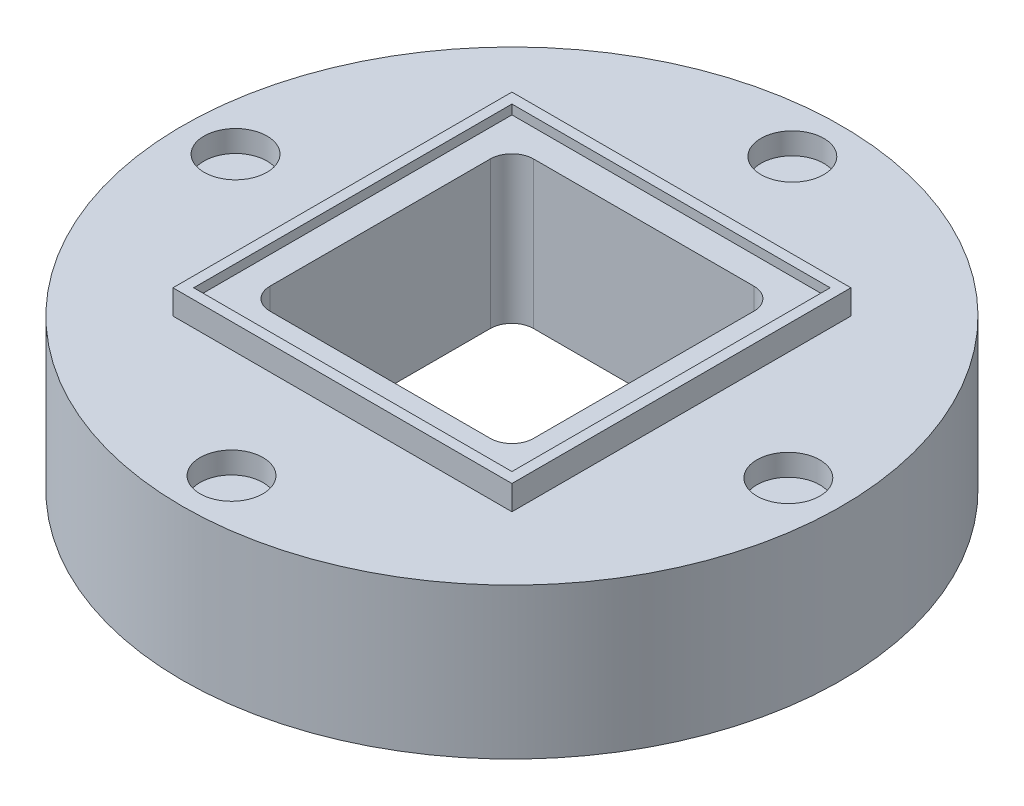
from build123d import *

# Parameters (mm, degrees)
SKETCH1_R           = 17.5
BOSS_EXTRUDE1_DEPTH = 8
SKETCH5_R           = 16.5
CUT_EXTRUDE2_DEPTH  = 1
SKETCH11_R          = 1.67
CUT_EXTRUDE5_DEPTH  = 1.15
CIRPATTERN1_COUNT   = 4
SKETCH13_W          = 18
SKETCH13_H          = 18
SKETCH13_W_2        = 16.9
SKETCH13_H_2        = 16.9
BOSS_EXTRUDE3_DEPTH = 1.3
SKETCH12_W          = 18
SKETCH12_H          = 18
BOSS_EXTRUDE2_DEPTH = 0.8
CUT_EXTRUDE6_DEPTH  = 27.266708968


with BuildPart() as part:
    # Sketch1 → Boss-Extrude1 (new body)
    with BuildSketch(Plane(origin=(0, 0, 0), x_dir=(1, 0, 0), z_dir=(0, 1, 0))):
        with Locations(Location((0, 0, 0), (0, 0, 270))):
            Circle(SKETCH1_R)
    extrude(amount=BOSS_EXTRUDE1_DEPTH)

    # Sketch5 → Cut-Extrude2 (cut)
    with BuildSketch(Plane.XZ):
        with Locations(Location((0, 0, 0), (0, 0, 270))):
            Circle(SKETCH5_R)
    extrude(amount=-CUT_EXTRUDE2_DEPTH, mode=Mode.SUBTRACT)

    # Sketch11 → Cut-Extrude5 (cut)
    with BuildSketch(Plane(origin=(0, 8, 0), x_dir=(1, 0, 0), z_dir=(0, 1, 0))):
        with Locations(Location((0.106708516, 14.783412681, 0), (0, 0, 270))):
            Circle(SKETCH11_R)
    cut_extrude5 = extrude(amount=-CUT_EXTRUDE5_DEPTH, mode=Mode.SUBTRACT)

    # CirPattern1: Cut-Extrude5 ×4 about axis
    cirpattern1_axis = Axis((0, 0, 0), (0, 1, 0))
    for i in range(1, CIRPATTERN1_COUNT):
        add(cut_extrude5.rotate(cirpattern1_axis, i * 360 / CIRPATTERN1_COUNT), mode=Mode.SUBTRACT)

    # Sketch13 → Boss-Extrude3 (add)
    with BuildSketch(Plane(origin=(0, 8, 0), x_dir=(1, 0, 0), z_dir=(0, 1, 0))):
        Rectangle(SKETCH13_W, SKETCH13_H)
        Rectangle(SKETCH13_W_2, SKETCH13_H_2, mode=Mode.SUBTRACT)
    extrude(amount=BOSS_EXTRUDE3_DEPTH)

    # Sketch12 → Boss-Extrude2 (add)
    with BuildSketch(Plane(origin=(0, 8, 0), x_dir=(1, 0, 0), z_dir=(0, 1, 0))):
        Rectangle(SKETCH12_W, SKETCH12_H)
    extrude(amount=BOSS_EXTRUDE2_DEPTH)

    # Sketch14 → Cut-Extrude6 (cut, through all)
    with BuildSketch(Plane(origin=(0, 8.8, 0), x_dir=(1, 0, 0), z_dir=(0, 1, 0))):
        with BuildLine():
            ThreePointArc((-7, -5.85), (-6.663172798, -6.663172798), (-5.85, -7))
            Line((-5.85, -7), (5.85, -7))
            ThreePointArc((5.85, -7), (6.663172798, -6.663172798), (7, -5.85))
            Line((7, -5.85), (7, 5.85))
            ThreePointArc((7, 5.85), (6.663172798, 6.663172798), (5.85, 7))
            Line((5.85, 7), (-5.85, 7))
            ThreePointArc((-5.85, 7), (-6.663172798, 6.663172798), (-7, 5.85))
            Line((-7, 5.85), (-7, -5.85))
        make_face()
    extrude(amount=-CUT_EXTRUDE6_DEPTH, mode=Mode.SUBTRACT)


solid = part.part
